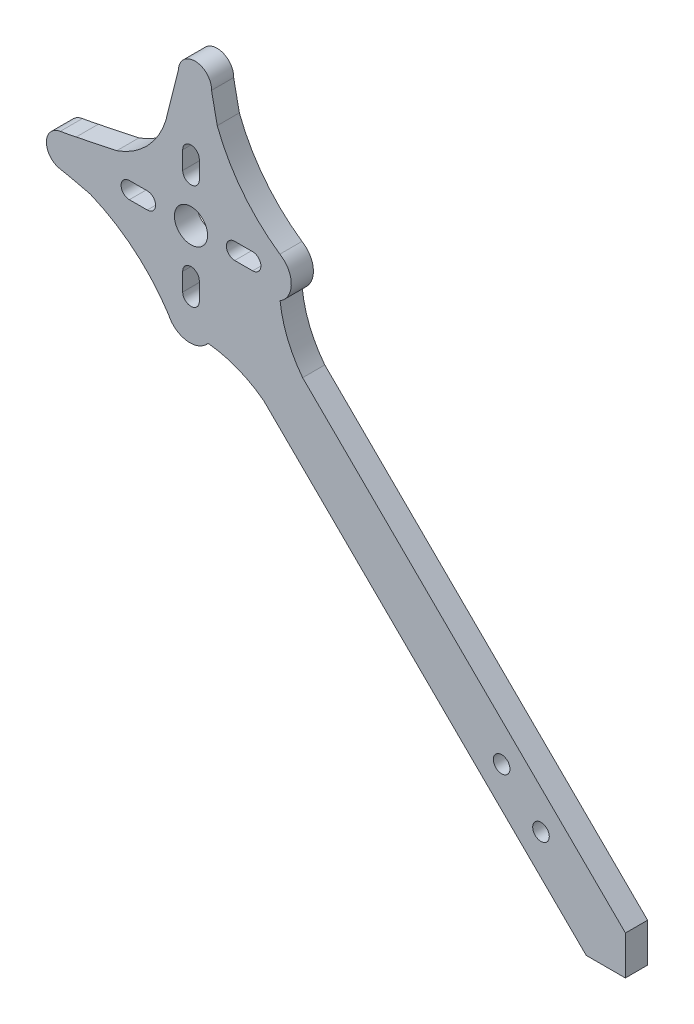
from build123d import *

# Parameters (mm, degrees)
SKETCH1_R           = 1.5
SKETCH1_R_2         = 3
BOSS_EXTRUDE3_DEPTH = 4


with BuildPart() as part:
    # Sketch1 → Boss-Extrude3 (new body)
    with BuildSketch(Plane.XY):
        with BuildLine():
            Line((-200.98277671, 120.578395112), (-198.686273407, 120.032535791))
            ThreePointArc((-198.686273407, 120.032535791), (-190.744400987, 115.221467643), (-184.584385258, 108.273524028))
            ThreePointArc((-184.584385258, 108.273524028), (-181.272141891, 105.819229993), (-177.439106824, 107.336582128))
            ThreePointArc((-177.439106824, 107.336582128), (-172.13122346, 106.059599202), (-167.370398947, 103.387734467))
            Line((-167.370398947, 103.387734467), (-109.095690378, 45.714454225))
            Line((-109.095690378, 45.714454225), (-102.024771817, 45.714454225))
            Line((-102.024771817, 45.714454225), (-102.007026705, 52.767627674))
            Line((-102.007026705, 52.767627674), (-160.345422779, 110.504595422))
            ThreePointArc((-160.345422779, 110.504595422), (-163.078925024, 115.23029925), (-164.424771817, 120.521141112))
            ThreePointArc((-164.424771817, 120.521141112), (-162.39977496, 124.16226761), (-164.46612922, 127.780083873))
            ThreePointArc((-164.46612922, 127.780083873), (-171.220620663, 134.151626828), (-175.784254213, 142.238218389))
            Line((-175.784254213, 142.238218389), (-176.812194105, 147.245164825))
            ThreePointArc((-176.812194105, 147.245164825), (-179.718163472, 150.336336453), (-182.8093351, 147.430367085))
            Line((-182.8093351, 147.430367085), (-184.649305769, 140.159568784))
            ThreePointArc((-184.649305769, 140.159568784), (-187.814666362, 133.438140211), (-193.944387613, 129.240089815))
            Line((-193.944387613, 129.240089815), (-201.286490927, 127.709234194))
            ThreePointArc((-201.286490927, 127.709234194), (-202.714852362, 127.426883631), (-204.148777392, 127.174302472))
            ThreePointArc((-204.148777392, 127.174302472), (-206.658919771, 124.247833074), (-204.214354736, 121.266367045))
            ThreePointArc((-204.214354736, 121.266367045), (-202.594506126, 120.941450032), (-200.98277671, 120.578395112))
        make_face()
        with Locations((-117.274771817, 60.964454225)):
            Circle(SKETCH1_R, mode=Mode.SUBTRACT)
        with Locations((-180.524771817, 124.214454225)):
            Circle(SKETCH1_R_2, mode=Mode.SUBTRACT)
        with Locations((-124.382381975, 67.998789861)):
            Circle(SKETCH1_R, mode=Mode.SUBTRACT)
        with BuildLine():
            Line((-182.024547822, 132.114454225), (-182.024547822, 135.348786972))
            ThreePointArc((-182.024547822, 135.348786972), (-180.524727129, 136.848607665), (-179.024906436, 135.348786972))
            Line((-179.024906436, 135.348786972), (-179.024906436, 132.114454225))
            ThreePointArc((-179.024906436, 132.114454225), (-180.524727129, 130.614633532), (-182.024547822, 132.114454225))
        make_face(mode=Mode.SUBTRACT)
        with BuildLine():
            Line((-182.024547822, 116.314454225), (-182.024547822, 113.080121478))
            ThreePointArc((-182.024547822, 113.080121478), (-180.524727129, 111.580300785), (-179.024906436, 113.080121478))
            Line((-179.024906436, 113.080121478), (-179.024906436, 116.314454225))
            ThreePointArc((-179.024906436, 116.314454225), (-180.524727129, 117.814274918), (-182.024547822, 116.314454225))
        make_face(mode=Mode.SUBTRACT)
        with BuildLine():
            Line((-172.624771818, 125.71423023), (-169.39043907, 125.71423023))
            ThreePointArc((-169.39043907, 125.71423023), (-167.890618373, 124.214409533), (-169.39043907, 122.714588836))
            Line((-169.39043907, 122.714588836), (-172.624771818, 122.714588836))
            ThreePointArc((-172.624771818, 122.714588836), (-174.124592515, 124.214409533), (-172.624771818, 125.71423023))
        make_face(mode=Mode.SUBTRACT)
        with BuildLine():
            Line((-188.424754849, 125.714319606), (-191.659087596, 125.714356198))
            ThreePointArc((-191.659087596, 125.714356198), (-193.158925261, 124.214552469), (-191.659121532, 122.714714804))
            Line((-191.659121532, 122.714714804), (-188.424788785, 122.714678212))
            ThreePointArc((-188.424788785, 122.714678212), (-186.92495112, 124.214481941), (-188.424754849, 125.714319606))
        make_face(mode=Mode.SUBTRACT)
    extrude(amount=BOSS_EXTRUDE3_DEPTH)


solid = part.part
